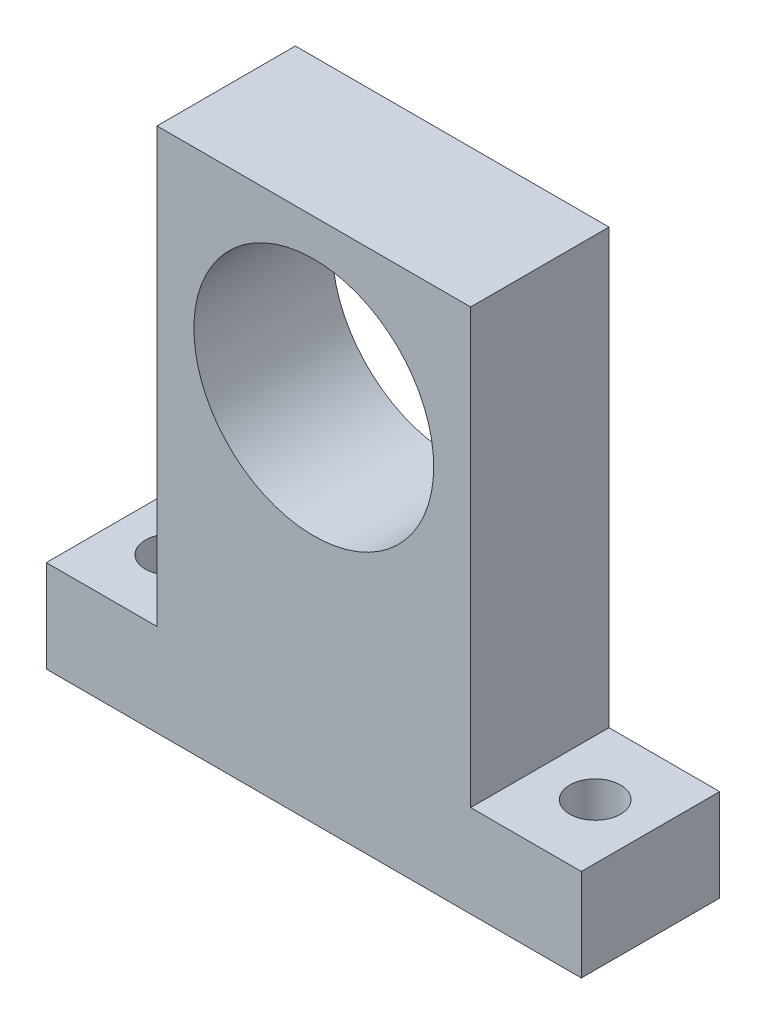
from build123d import *

# Parameters (mm, degrees)
SKETCH_1_R          = 13
EXTRUDE_1_DEPTH     = 15
SKETCH_2_R          = 2.75
CUT_EXTRUDE_1_DEPTH = 58.227615711


with BuildPart() as part:
    # 草图1 → 凸台-拉伸1 (new body)
    with BuildSketch(Plane.XY):
        Polygon((17, 0), (-17, 0), (-17, -47), (-29, -47), (-29, -57), (29, -57), (29, -47), (17, -47), align=None)
        with Locations((0, -17)):
            Circle(SKETCH_1_R, mode=Mode.SUBTRACT)
    extrude(amount=EXTRUDE_1_DEPTH)

    # 草图2 → 切除-拉伸1 (cut, through all)
    with BuildSketch(Plane(origin=(0, -47, 0), x_dir=(1, 0, 0), z_dir=(0, 1, 0))):
        with Locations(Location((-23, -7.5, 0), (0, 0, 270))):
            Circle(SKETCH_2_R)
        with Locations(Location((23, -7.5, 0), (0, 0, 90))):
            Circle(SKETCH_2_R)
    extrude(amount=-CUT_EXTRUDE_1_DEPTH, mode=Mode.SUBTRACT)


solid = part.part
